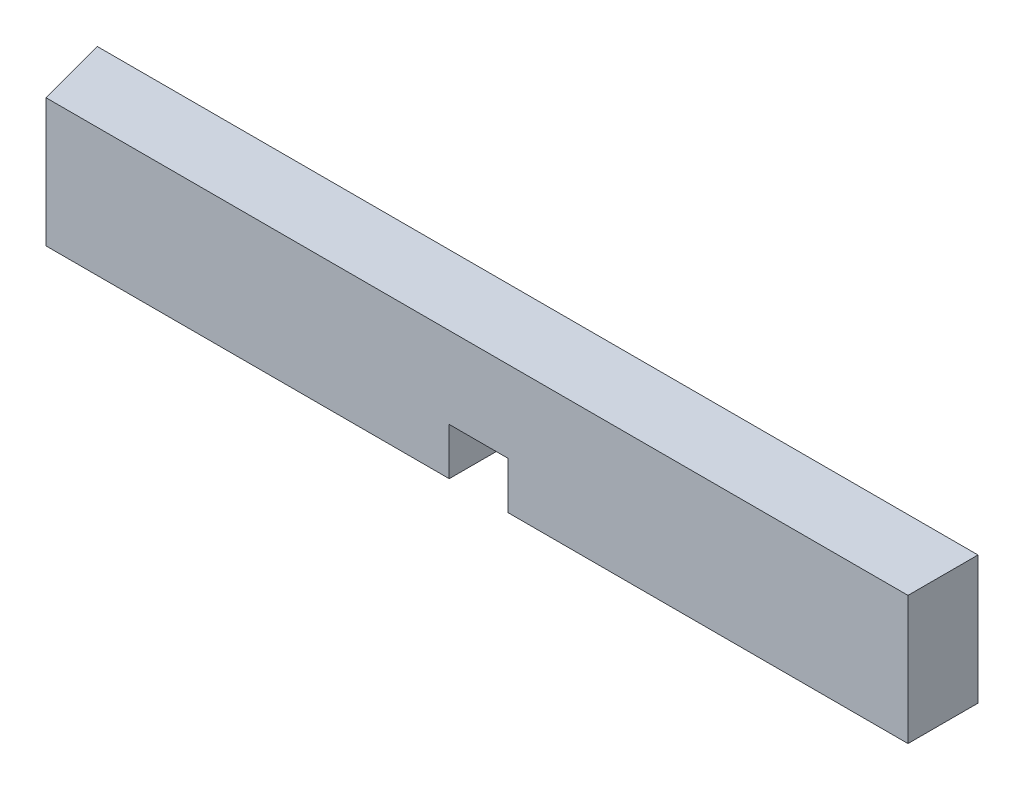
from build123d import *

# Parameters (mm, degrees)
CROQUIS1_W                 = 58.7375
CROQUIS1_H                 = 8.6614
SALIENTE_EXTRUIR1_DEPTH    = 4.7244
CORTAR_EXTRUIR2_DEPTH      = 60.560336732
CORTAR_EXTRUIR2_DEPTH_BACK = 60.560336732
CROQUIS2_W                 = 3.96875
CROQUIS2_H                 = 3.175
CORTAR_EXTRUIR4_DEPTH      = 60.560336732
SALIENTE_EXTRUIR2_DEPTH    = 8.6614


with BuildPart() as part:
    # Croquis1 → Saliente-Extruir1 (new body)
    with BuildSketch(Plane.XY):
        with Locations((29.36875, 4.3307)):
            Rectangle(CROQUIS1_W, CROQUIS1_H)
    extrude(amount=SALIENTE_EXTRUIR1_DEPTH)

    # Croquis2 → Cortar-Extruir2 (cut, two sides: drawn at the far end of the back side and taken through both)
    with BuildSketch(Plane.XY.offset(-CORTAR_EXTRUIR2_DEPTH_BACK)):
        with Locations((29.765625, 1.5875)):
            Rectangle(CROQUIS2_W, CROQUIS2_H)
    extrude(amount=CORTAR_EXTRUIR2_DEPTH + CORTAR_EXTRUIR2_DEPTH_BACK, mode=Mode.SUBTRACT)

    # Croquis4 → Cortar-Extruir4 (cut, through all)
    with BuildSketch(Plane(origin=(0, 8.6614, 0), x_dir=(1, 0, 0), z_dir=(0, 1, 0))):
        Polygon((0.5715, -4.7244), (0, -4.7244), (0, -2.223247059), align=None)
    extrude(amount=-CORTAR_EXTRUIR4_DEPTH, mode=Mode.SUBTRACT)

    # Croquis5 → Saliente-Extruir2 (add)
    with BuildSketch(Plane(origin=(0, 8.6614, 0), x_dir=(1, 0, 0), z_dir=(0, 1, 0))):
        Polygon((-0.6985, 0), (0.28575, 0), (0.5715, -4.7244), align=None)
    extrude(amount=-SALIENTE_EXTRUIR2_DEPTH)


solid = part.part
